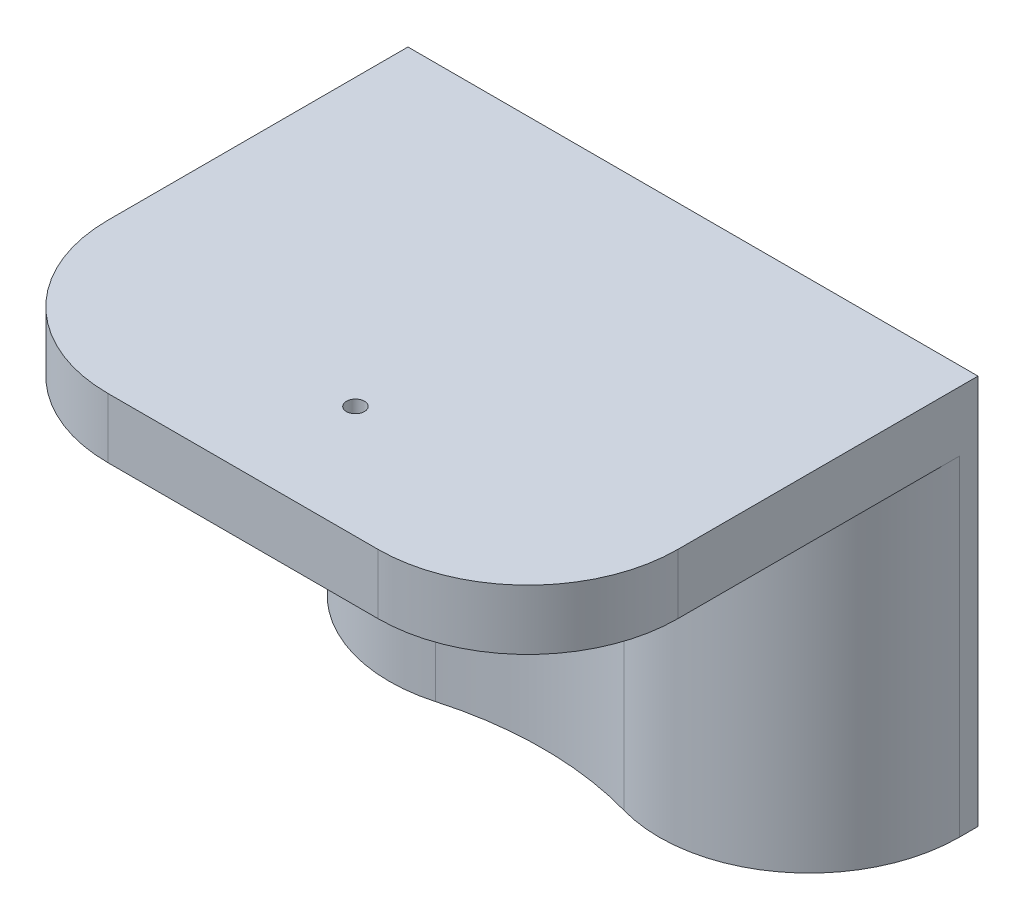
from build123d import *

# Parameters (mm, degrees)
CROQUIS2_R              = 0.6
SALIENTE_EXTRUIR1_DEPTH = 4
SALIENTE_EXTRUIR2_DEPTH = 22
REDONDEO1_R             = 10
REDONDEO2_R             = 10


with BuildPart() as part:
    # Croquis2 → Saliente-Extruir1 (new body)
    with BuildSketch(Plane(origin=(0, 0, 0), x_dir=(1, 0, 0), z_dir=(0, 1, 0))):
        with BuildLine():
            Line((-43.107082341, -17.625158928), (-5.107082341, -17.625158928))
            Line((-5.107082341, -17.625158928), (-5.107082341, -37.625158928))
            ThreePointArc((-5.107082341, -37.625158928), (-8.036014529, -44.69622674), (-15.107082341, -47.625158928))
            Line((-15.107082341, -47.625158928), (-33.107082341, -47.625158928))
            ThreePointArc((-33.107082341, -47.625158928), (-40.178150153, -44.69622674), (-43.107082341, -37.625158928))
            Line((-43.107082341, -37.625158928), (-43.107082341, -17.625158928))
        make_face()
        with Locations(Location((-24.107082341, -40.125158928, 0), (0, 0, 270))):
            Circle(CROQUIS2_R, mode=Mode.SUBTRACT)
    extrude(amount=SALIENTE_EXTRUIR1_DEPTH)

    # Croquis3 → Saliente-Extruir2 (add)
    with BuildSketch(Plane.XZ):
        with BuildLine():
            Line((-43.107082341, 17.625158928), (-5.107082341, 17.625158928))
            Line((-5.107082341, 17.625158928), (-5.107082341, 37.625158928))
            ThreePointArc((-5.107082341, 37.625158928), (-24.107082341, 27.625158928), (-43.107082341, 37.625158928))
            Line((-43.107082341, 37.625158928), (-43.107082341, 17.625158928))
        make_face()
    extrude(amount=SALIENTE_EXTRUIR2_DEPTH)

    # Redondeo1
    redondeo1_edges = [part.edges().sort_by_distance(p)[0] for p in [
        (-43.107082341, -11, 37.625158928),
    ]]
    fillet(redondeo1_edges, radius=REDONDEO1_R)

    # Redondeo2
    redondeo2_edges = [part.edges().sort_by_distance(p)[0] for p in [
        (-5.107082341, -11, 37.625158928),
    ]]
    fillet(redondeo2_edges, radius=REDONDEO2_R)


solid = part.part
